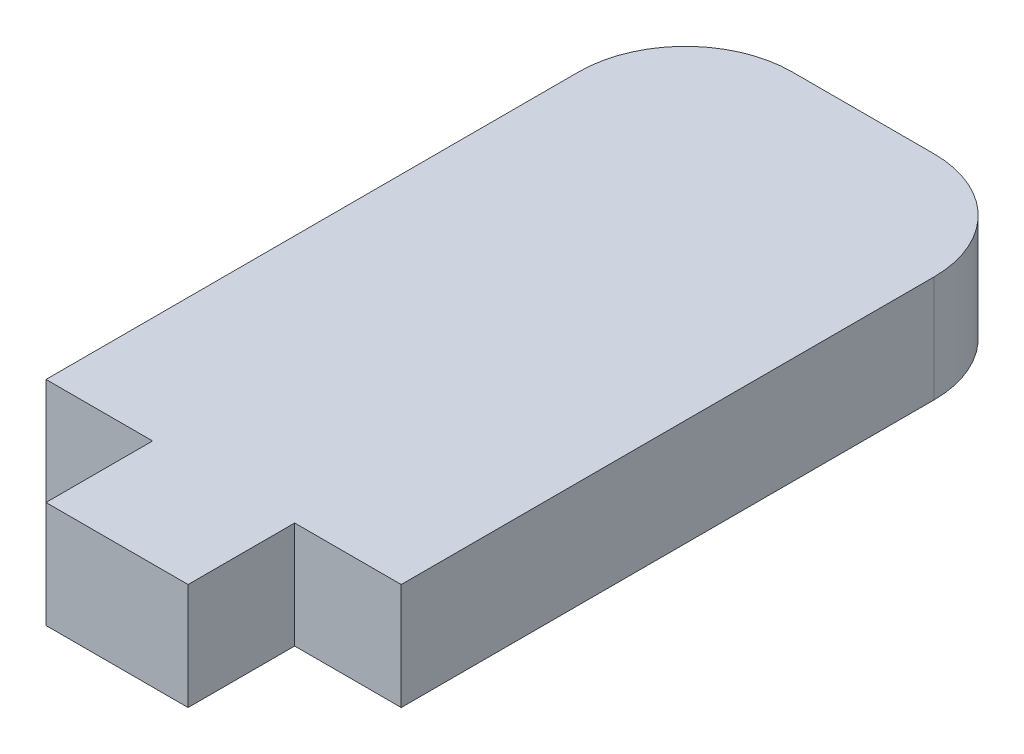
from build123d import *

# Parameters (mm, degrees)
BOSS_EXTRUDE4_DEPTH = 1.5
SKETCH8_W           = 4
SKETCH8_H           = 3
BOSS_EXTRUDE5_DEPTH = 1.5


with BuildPart() as part:
    # Sketch6 → Boss-Extrude4 (new, symmetric)
    with BuildSketch(Plane(origin=(0, 0, 0), x_dir=(1, 0, 0), z_dir=(0, 1, 0))):
        with BuildLine():
            Line((-2, 10.5), (2, 10.5))
            ThreePointArc((2, 10.5), (4.121320344, 9.621320344), (5, 7.5))
            Line((5, 7.5), (5, -7.5))
            Line((5, -7.5), (-5, -7.5))
            Line((-5, -7.5), (-5, 7.5))
            ThreePointArc((-5, 7.5), (-4.121320344, 9.621320344), (-2, 10.5))
        make_face()
    extrude(amount=BOSS_EXTRUDE4_DEPTH, both=True)

    # Sketch8 → Boss-Extrude5 (add, symmetric)
    with BuildSketch(Plane(origin=(0, 0, 0), x_dir=(1, 0, 0), z_dir=(0, 1, 0))):
        with Locations((0, -9)):
            Rectangle(SKETCH8_W, SKETCH8_H)
    extrude(amount=BOSS_EXTRUDE5_DEPTH, both=True)


solid = part.part
